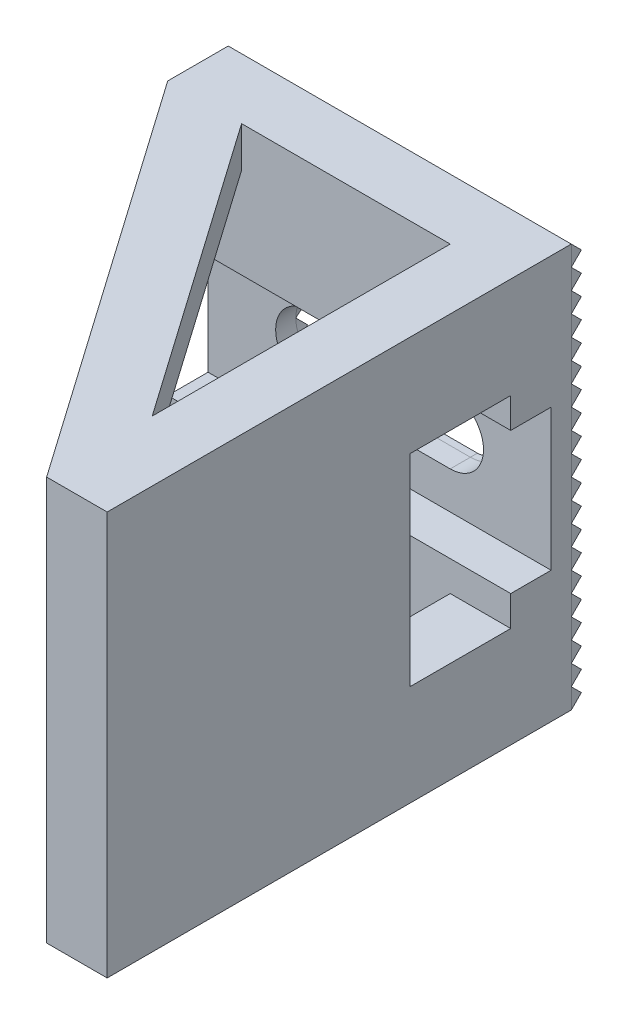
from build123d import *

# Parameters (mm, degrees)
SKETCH1_W              = 17
SKETCH1_H              = 20
BOSS_EXTRUDE1_DEPTH    = 3
SKETCH2_W              = 3
SKETCH2_H              = 20
BOSS_EXTRUDE2_DEPTH    = 20
BOSS_EXTRUDE3_DEPTH    = 2
BOSS_EXTRUDE4_START    = -20
BOSS_EXTRUDE4_DEPTH    = 2
SKETCH4_W              = 5
SKETCH4_H              = 10
CUT_EXTRUDE1_DEPTH     = 12
BOSS_EXTRUDE9_DEPTH    = 17
BOSS_EXTRUDE9_2_DEPTH  = 17
BOSS_EXTRUDE9_3_DEPTH  = 17
BOSS_EXTRUDE9_4_DEPTH  = 17
BOSS_EXTRUDE9_5_DEPTH  = 17
BOSS_EXTRUDE9_6_DEPTH  = 17
BOSS_EXTRUDE9_7_DEPTH  = 17
BOSS_EXTRUDE9_8_DEPTH  = 17
BOSS_EXTRUDE9_9_DEPTH  = 17
BOSS_EXTRUDE9_10_DEPTH = 17
BOSS_EXTRUDE9_11_DEPTH = 17
BOSS_EXTRUDE9_12_DEPTH = 17
BOSS_EXTRUDE9_13_DEPTH = 17
BOSS_EXTRUDE9_14_DEPTH = 17
BOSS_EXTRUDE9_15_DEPTH = 17
BOSS_EXTRUDE9_16_DEPTH = 17
BOSS_EXTRUDE9_17_DEPTH = 17
BOSS_EXTRUDE9_18_DEPTH = 17
BOSS_EXTRUDE9_19_DEPTH = 17
BOSS_EXTRUDE9_20_DEPTH = 17
CUT_EXTRUDE2_DEPTH     = 10
SKETCH8_W              = 17
SKETCH8_H              = 7
CUT_EXTRUDE3_DEPTH     = 2


with BuildPart() as part:
    # Sketch1 → Boss-Extrude1 (new body)
    with BuildSketch(Plane.XY):
        Rectangle(SKETCH1_W, SKETCH1_H)
    extrude(amount=BOSS_EXTRUDE1_DEPTH)

    # Sketch2 → Boss-Extrude2 (add)
    with BuildSketch(Plane.XY.offset(3)):
        with Locations((7, 0)):
            Rectangle(SKETCH2_W, SKETCH2_H)
    extrude(amount=BOSS_EXTRUDE2_DEPTH)

    # Sketch3 → Boss-Extrude3 (add)
    with BuildSketch(Plane.XZ.offset(10)):
        Polygon((5.5, 23), (-8.5, 3), (-4.838033315, 3), (5.5, 17.768619022), align=None)
    extrude(amount=-BOSS_EXTRUDE3_DEPTH)

    # Sketch3<2> → Boss-Extrude4 (add)
    with BuildSketch(Plane.XZ.offset(10).offset(BOSS_EXTRUDE4_START)):
        Polygon((5.5, 23), (-8.5, 3), (-4.838033315, 3), (5.5, 17.768619022), align=None)
    extrude(amount=BOSS_EXTRUDE4_DEPTH)

    # Sketch4 → Cut-Extrude1 (cut)
    with BuildSketch(Plane.ZY.offset(-5.5)):
        with Locations((5.5, 0)):
            Rectangle(SKETCH4_W, SKETCH4_H)
    extrude(amount=-CUT_EXTRUDE1_DEPTH, mode=Mode.SUBTRACT)


with BuildPart() as body_2:
    # Sketch5 → Boss-Extrude9 (new body)
    with BuildSketch(Plane(origin=(8.5, 0, 0), x_dir=(0, 0, -1), z_dir=(1, 0, 0))):
        Polygon((0.5, -9.5), (0, -9), (0, -10), align=None)
    extrude(amount=-BOSS_EXTRUDE9_DEPTH)


with BuildPart() as body_3:
    # Sketch5 → Boss-Extrude9 2 (new body)
    with BuildSketch(Plane(origin=(8.5, 0, 0), x_dir=(0, 0, -1), z_dir=(1, 0, 0))):
        Polygon((0.5, -0.5), (0, 0), (0, -1), align=None)
    extrude(amount=-BOSS_EXTRUDE9_2_DEPTH)


with BuildPart() as body_4:
    # Sketch5 → Boss-Extrude9 3 (new body)
    with BuildSketch(Plane(origin=(8.5, 0, 0), x_dir=(0, 0, -1), z_dir=(1, 0, 0))):
        Polygon((0.5, 0.5), (0, 1), (0, 0), align=None)
    extrude(amount=-BOSS_EXTRUDE9_3_DEPTH)


with BuildPart() as body_5:
    # Sketch5 → Boss-Extrude9 4 (new body)
    with BuildSketch(Plane(origin=(8.5, 0, 0), x_dir=(0, 0, -1), z_dir=(1, 0, 0))):
        Polygon((0.5, 1.5), (0, 2), (0, 1), align=None)
    extrude(amount=-BOSS_EXTRUDE9_4_DEPTH)


with BuildPart() as body_6:
    # Sketch5 → Boss-Extrude9 5 (new body)
    with BuildSketch(Plane(origin=(8.5, 0, 0), x_dir=(0, 0, -1), z_dir=(1, 0, 0))):
        Polygon((0, -8), (0, -9), (0.5, -8.5), align=None)
    extrude(amount=-BOSS_EXTRUDE9_5_DEPTH)


with BuildPart() as body_7:
    # Sketch5 → Boss-Extrude9 6 (new body)
    with BuildSketch(Plane(origin=(8.5, 0, 0), x_dir=(0, 0, -1), z_dir=(1, 0, 0))):
        Polygon((0, -7), (0, -8), (0.5, -7.5), align=None)
    extrude(amount=-BOSS_EXTRUDE9_6_DEPTH)


with BuildPart() as body_8:
    # Sketch5 → Boss-Extrude9 7 (new body)
    with BuildSketch(Plane(origin=(8.5, 0, 0), x_dir=(0, 0, -1), z_dir=(1, 0, 0))):
        Polygon((0, -6), (0, -7), (0.5, -6.5), align=None)
    extrude(amount=-BOSS_EXTRUDE9_7_DEPTH)


with BuildPart() as body_9:
    # Sketch5 → Boss-Extrude9 8 (new body)
    with BuildSketch(Plane(origin=(8.5, 0, 0), x_dir=(0, 0, -1), z_dir=(1, 0, 0))):
        Polygon((0, -5), (0, -6), (0.5, -5.5), align=None)
    extrude(amount=-BOSS_EXTRUDE9_8_DEPTH)


with BuildPart() as body_10:
    # Sketch5 → Boss-Extrude9 9 (new body)
    with BuildSketch(Plane(origin=(8.5, 0, 0), x_dir=(0, 0, -1), z_dir=(1, 0, 0))):
        Polygon((0, -4), (0, -5), (0.5, -4.5), align=None)
    extrude(amount=-BOSS_EXTRUDE9_9_DEPTH)


with BuildPart() as body_11:
    # Sketch5 → Boss-Extrude9 10 (new body)
    with BuildSketch(Plane(origin=(8.5, 0, 0), x_dir=(0, 0, -1), z_dir=(1, 0, 0))):
        Polygon((0, -3), (0, -4), (0.5, -3.5), align=None)
    extrude(amount=-BOSS_EXTRUDE9_10_DEPTH)


with BuildPart() as body_12:
    # Sketch5 → Boss-Extrude9 11 (new body)
    with BuildSketch(Plane(origin=(8.5, 0, 0), x_dir=(0, 0, -1), z_dir=(1, 0, 0))):
        Polygon((0, -2), (0, -3), (0.5, -2.5), align=None)
    extrude(amount=-BOSS_EXTRUDE9_11_DEPTH)


with BuildPart() as body_13:
    # Sketch5 → Boss-Extrude9 12 (new body)
    with BuildSketch(Plane(origin=(8.5, 0, 0), x_dir=(0, 0, -1), z_dir=(1, 0, 0))):
        Polygon((0, -1), (0, -2), (0.5, -1.5), align=None)
    extrude(amount=-BOSS_EXTRUDE9_12_DEPTH)


with BuildPart() as body_14:
    # Sketch5 → Boss-Extrude9 13 (new body)
    with BuildSketch(Plane(origin=(8.5, 0, 0), x_dir=(0, 0, -1), z_dir=(1, 0, 0))):
        Polygon((0, 3), (0, 2), (0.5, 2.5), align=None)
    extrude(amount=-BOSS_EXTRUDE9_13_DEPTH)


with BuildPart() as body_15:
    # Sketch5 → Boss-Extrude9 14 (new body)
    with BuildSketch(Plane(origin=(8.5, 0, 0), x_dir=(0, 0, -1), z_dir=(1, 0, 0))):
        Polygon((0, 4), (0, 3), (0.5, 3.5), align=None)
    extrude(amount=-BOSS_EXTRUDE9_14_DEPTH)


with BuildPart() as body_16:
    # Sketch5 → Boss-Extrude9 15 (new body)
    with BuildSketch(Plane(origin=(8.5, 0, 0), x_dir=(0, 0, -1), z_dir=(1, 0, 0))):
        Polygon((0, 5), (0, 4), (0.5, 4.5), align=None)
    extrude(amount=-BOSS_EXTRUDE9_15_DEPTH)


with BuildPart() as body_17:
    # Sketch5 → Boss-Extrude9 16 (new body)
    with BuildSketch(Plane(origin=(8.5, 0, 0), x_dir=(0, 0, -1), z_dir=(1, 0, 0))):
        Polygon((0, 6), (0, 5), (0.5, 5.5), align=None)
    extrude(amount=-BOSS_EXTRUDE9_16_DEPTH)


with BuildPart() as body_18:
    # Sketch5 → Boss-Extrude9 17 (new body)
    with BuildSketch(Plane(origin=(8.5, 0, 0), x_dir=(0, 0, -1), z_dir=(1, 0, 0))):
        Polygon((0, 7), (0, 6), (0.5, 6.5), align=None)
    extrude(amount=-BOSS_EXTRUDE9_17_DEPTH)


with BuildPart() as body_19:
    # Sketch5 → Boss-Extrude9 18 (new body)
    with BuildSketch(Plane(origin=(8.5, 0, 0), x_dir=(0, 0, -1), z_dir=(1, 0, 0))):
        Polygon((0, 8), (0, 7), (0.5, 7.5), align=None)
    extrude(amount=-BOSS_EXTRUDE9_18_DEPTH)


with BuildPart() as body_20:
    # Sketch5 → Boss-Extrude9 19 (new body)
    with BuildSketch(Plane(origin=(8.5, 0, 0), x_dir=(0, 0, -1), z_dir=(1, 0, 0))):
        Polygon((0, 9), (0, 8), (0.5, 8.5), align=None)
    extrude(amount=-BOSS_EXTRUDE9_19_DEPTH)


with BuildPart() as body_21:
    # Sketch5 → Boss-Extrude9 20 (new body)
    with BuildSketch(Plane(origin=(8.5, 0, 0), x_dir=(0, 0, -1), z_dir=(1, 0, 0))):
        Polygon((0, 10), (0, 9), (0.5, 9.5), align=None)
    extrude(amount=-BOSS_EXTRUDE9_20_DEPTH)


with BuildPart() as cut_extrude2_tool:
    # Sketch6 → Cut-Extrude2 (new body)
    with BuildSketch(Plane.XY.offset(3)):
        with BuildLine():
            Line((3.5, -1.65), (-3.5, -1.65))
            ThreePointArc((-3.5, -1.65), (-5.15, 0), (-3.5, 1.65))
            Line((-3.5, 1.65), (3.5, 1.65))
            ThreePointArc((3.5, 1.65), (5.15, 0), (3.5, -1.65))
        make_face()
    extrude(amount=-CUT_EXTRUDE2_DEPTH)


with BuildPart() as part_1:
    add(part.part)

    # Cut-Extrude2: cut by cut_extrude2_tool
    add(cut_extrude2_tool.part, mode=Mode.SUBTRACT)

    # Sketch8 → Cut-Extrude3 (cut)
    with BuildSketch(Plane.XY.offset(3)):
        Rectangle(SKETCH8_W, SKETCH8_H)
    extrude(amount=-CUT_EXTRUDE3_DEPTH, mode=Mode.SUBTRACT)


with BuildPart() as body_3_1:
    add(body_3.part)

    # Cut-Extrude2: cut by cut_extrude2_tool
    add(cut_extrude2_tool.part, mode=Mode.SUBTRACT)


with BuildPart() as body_4_1:
    add(body_4.part)

    # Cut-Extrude2: cut by cut_extrude2_tool
    add(cut_extrude2_tool.part, mode=Mode.SUBTRACT)


with BuildPart() as body_5_1:
    add(body_5.part)

    # Cut-Extrude2: cut by cut_extrude2_tool
    add(cut_extrude2_tool.part, mode=Mode.SUBTRACT)


with BuildPart() as body_13_1:
    add(body_13.part)

    # Cut-Extrude2: cut by cut_extrude2_tool
    add(cut_extrude2_tool.part, mode=Mode.SUBTRACT)


solid = Compound([body_2.part, body_6.part, body_7.part, body_8.part, body_9.part, body_10.part, body_11.part, body_12.part, body_14.part, body_15.part, body_16.part, body_17.part, body_18.part, body_19.part, body_20.part, body_21.part, part_1.part, body_3_1.part, body_4_1.part, body_5_1.part, body_13_1.part])
